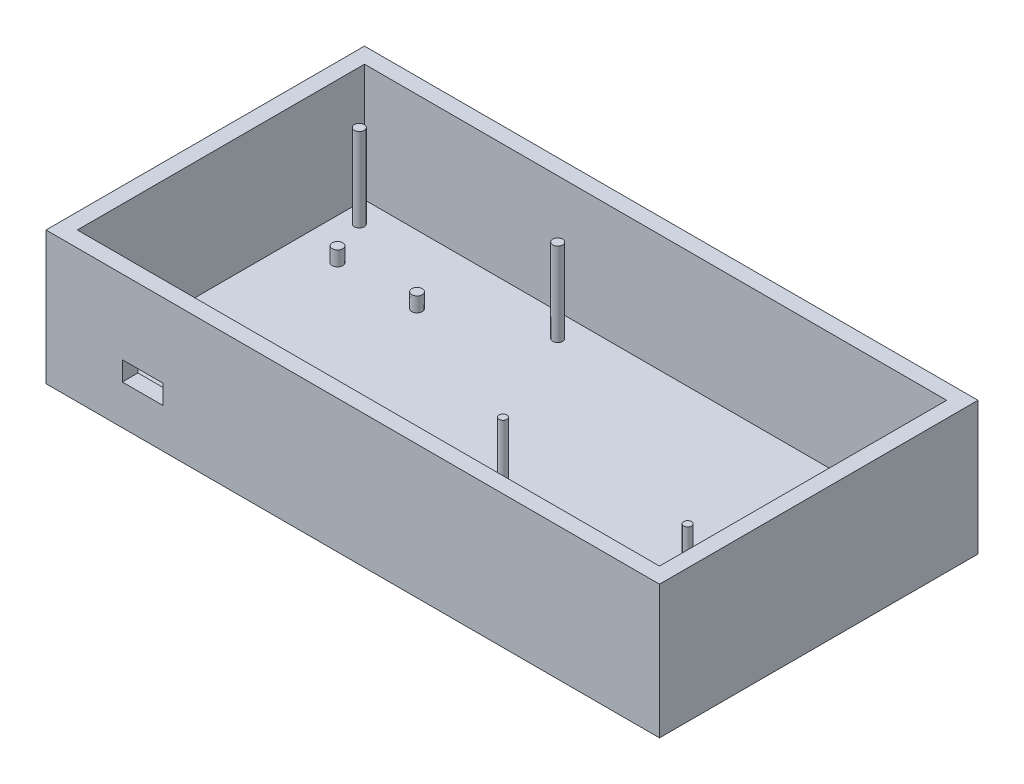
from build123d import *

# Parameters (mm, degrees)
ESBO_O_W                 = 111.5
ESBO_O_H                 = 55
RESSALTO_EXTRUS_O1_DEPTH = 22.5
CASCA3_T                 = 3
ESBO_O12_R               = 0.95
RESSALTO_EXTRUS_O2_DEPTH = 16
ESBO_O15_W               = 7.8
ESBO_O15_H               = 3.7
USB_DEPTH                = 3.9
ESBO_O16_R               = 1
RESSALTO_EXTRUS_O4_DEPTH = 2.81
ESBO_O17_R               = 0.74
RESSALTO_EXTRUS_O5_DEPTH = 12.6


with BuildPart() as part:
    # Esboço → Ressalto-extrusão1 (new body)
    with BuildSketch(Plane(origin=(0, 0, 0), x_dir=(1, 0, 0), z_dir=(0, 1, 0))):
        with Locations((-36.607366715, 20.784772609)):
            Rectangle(ESBO_O_W, ESBO_O_H)
    extrude(amount=RESSALTO_EXTRUS_O1_DEPTH)

    # Casca3
    casca3_openings = [part.faces().sort_by_distance(p)[0] for p in [
        (-36.607366715, 22.5, -20.784772609),
    ]]
    offset(amount=CASCA3_T, openings=casca3_openings, kind=Kind.INTERSECTION)

    # Esboço12 → Ressalto-extrusão2 (add)
    with BuildSketch(Plane(origin=(0, 0, 0), x_dir=(1, 0, 0), z_dir=(0, 1, 0))):
        with Locations(Location((-50.857366715, 43.784772609, 0), (0, 0, 270))):
            Circle(ESBO_O12_R)
        with Locations(Location((-88.857366715, 43.784772609, 0), (0, 0, 270))):
            Circle(ESBO_O12_R)
        with Locations(Location((-88.857366715, -2.215227391, 0), (0, 0, 270))):
            Circle(ESBO_O12_R)
        with Locations(Location((-50.857366715, -2.215227391, 0), (0, 0, 270))):
            Circle(ESBO_O12_R)
    extrude(amount=RESSALTO_EXTRUS_O2_DEPTH)

    # Esboço15 → usb (cut)
    with BuildSketch(Plane.XY.offset(9.715227391)):
        with Locations((-76.847366715, 6.44)):
            Rectangle(ESBO_O15_W, ESBO_O15_H)
    extrude(amount=-USB_DEPTH, mode=Mode.SUBTRACT)

    # Esboço16 → Ressalto-extrusão4 (add)
    with BuildSketch(Plane(origin=(0, 0, 0), x_dir=(1, 0, 0), z_dir=(0, 1, 0))):
        with Locations(Location((-84.517607583, 35.272111724, 0), (0, 0, 270))):
            Circle(ESBO_O16_R)
        with Locations(Location((-69.277607583, 35.272111724, 0), (0, 0, 270))):
            Circle(ESBO_O16_R)
        with Locations(Location((-69.277607583, -5.367888276, 0), (0, 0, 270))):
            Circle(ESBO_O16_R)
        with Locations(Location((-84.517607583, -5.367888276, 0), (0, 0, 270))):
            Circle(ESBO_O16_R)
    extrude(amount=RESSALTO_EXTRUS_O4_DEPTH)

    # Esboço17 → Ressalto-extrusão5 (add)
    with BuildSketch(Plane(origin=(0, 0, 0), x_dir=(1, 0, 0), z_dir=(0, 1, 0))):
        with Locations(Location((-30.447366715, 12.894772609, 0), (0, 0, 270))):
            Circle(ESBO_O17_R)
        with Locations(Location((4.912633285, 12.894772609, 0), (0, 0, 270))):
            Circle(ESBO_O17_R)
        with Locations(Location((4.912633285, -4.415227391, 0), (0, 0, 270))):
            Circle(ESBO_O17_R)
        with Locations(Location((-30.447366715, -4.415227391, 0), (0, 0, 270))):
            Circle(ESBO_O17_R)
    extrude(amount=RESSALTO_EXTRUS_O5_DEPTH)


solid = part.part
